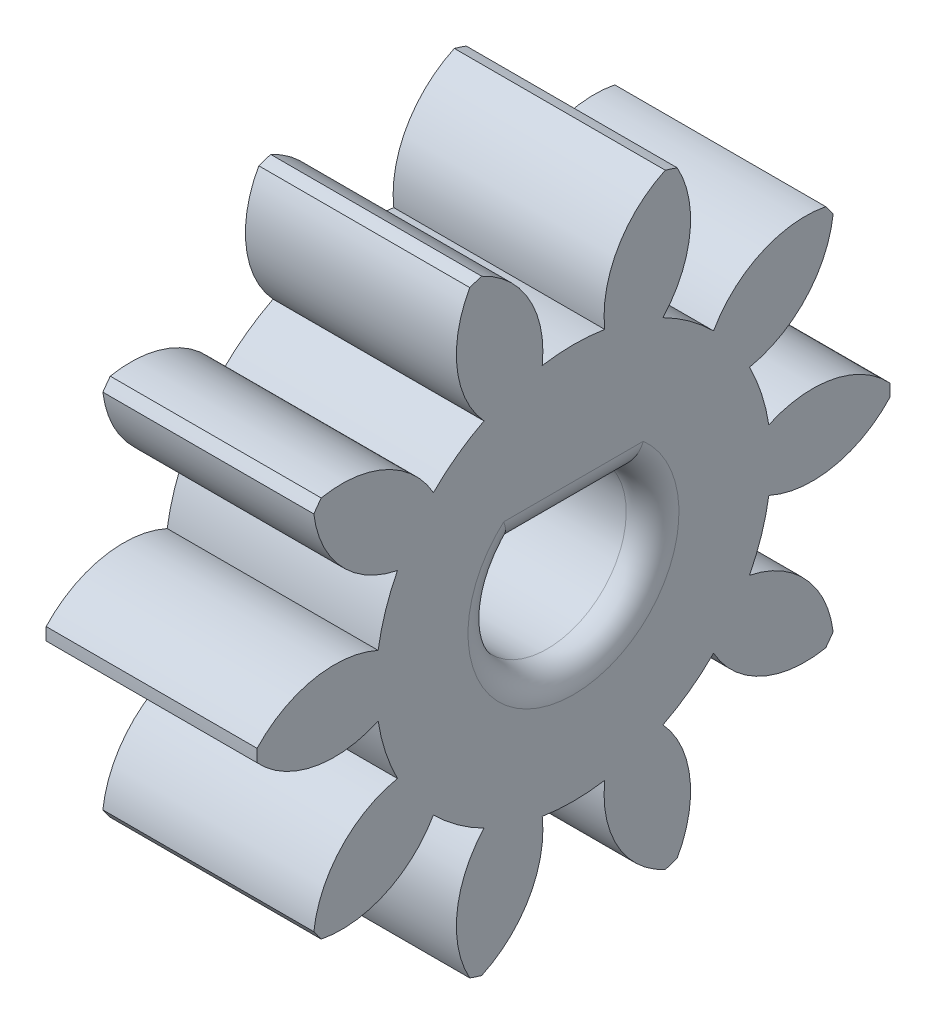
from build123d import *

# Parameters (mm, degrees)
BASPROSKE_W         = 4
BASPROSKE_H         = 6
TOOTHCUT_DEPTH      = 10.38083152
TEETHCUTS_COUNT     = 10
TEETHCUTS_ANGLE     = 324
BORSKE_R            = 2.5
BORE_DEPTH          = 50.0000508
SKETCH1_R           = 2.5
BOSS_EXTRUDE1_DEPTH = 4
FILLET1_R           = 0.5


with BuildPart() as part:
    # BasProSke → Base-Revolve (revolve)
    with BuildSketch(Plane(origin=(0, 0, 0), x_dir=(1, 0, 0), z_dir=(0, 1, 0)), mode=Mode.PRIVATE) as base_revolve_sk:
        with Locations((2, 3)):
            Rectangle(BASPROSKE_W, BASPROSKE_H)
    revolve(base_revolve_sk.sketch.rotate(Axis((-10, 0, 0), (1, 0, 0)), 180), axis=Axis((-10, 0, 0), (1, 0, 0)))

    # TooCutSke → ToothCut (cut, through all)
    with BuildSketch(Plane(origin=(0, 0, 0), x_dir=(0, 0, -1), z_dir=(1, 0, 0))):
        with BuildLine():
            ThreePointArc((0.59278292, 3.701838653), (0, 3.749), (-0.59278292, 3.701838653))
            ThreePointArc((-0.59278292, 3.701838653), (-0.846593509, 4.924114224), (-1.775771316, 5.757784417))
            ThreePointArc((-1.775771316, 5.757784417), (0, 6.0254), (1.775771316, 5.757784417))
            ThreePointArc((1.775771316, 5.757784417), (0.846593509, 4.924114224), (0.59278292, 3.701838653))
        make_face()
    toothcut = extrude(amount=TOOTHCUT_DEPTH, mode=Mode.SUBTRACT)

    # TeethCuts: ToothCut ×10 about axis
    teethcuts_axis = Axis((-10, 0, 0), (1, 0, 0))
    for i in range(1, TEETHCUTS_COUNT):
        add(toothcut.rotate(teethcuts_axis, i * TEETHCUTS_ANGLE / (TEETHCUTS_COUNT - 1)), mode=Mode.SUBTRACT)

    # BorSke → Bore (cut, symmetric)
    with BuildSketch(Plane(origin=(0, 0, 0), x_dir=(0, 0, -1), z_dir=(1, 0, 0))):
        with Locations(Location((0, 0, 0), (0, 0, 180))):
            Circle(BORSKE_R)
    extrude(amount=BORE_DEPTH, both=True, mode=Mode.SUBTRACT)

    # Sketch1 → Boss-Extrude1 (add)
    with BuildSketch(Plane(origin=(4, 0, 0), x_dir=(0, 0, -1), z_dir=(1, 0, 0))):
        Circle(SKETCH1_R)
        with BuildLine():
            Line((-1.118033989, 1), (1.118033989, 1))
            ThreePointArc((1.118033989, 1), (0, -1.5), (-1.118033989, 1))
        make_face(mode=Mode.SUBTRACT)
    extrude(amount=-BOSS_EXTRUDE1_DEPTH)

    # Fillet1
    fillet1_edges = [part.edges().sort_by_distance(p)[0] for p in [
        (0, 1, 0),
        (4, 1, 0),
        (0, -1.5, 0),
        (4, -1.5, 0),
    ]]
    fillet(fillet1_edges, radius=FILLET1_R)


solid = part.part
